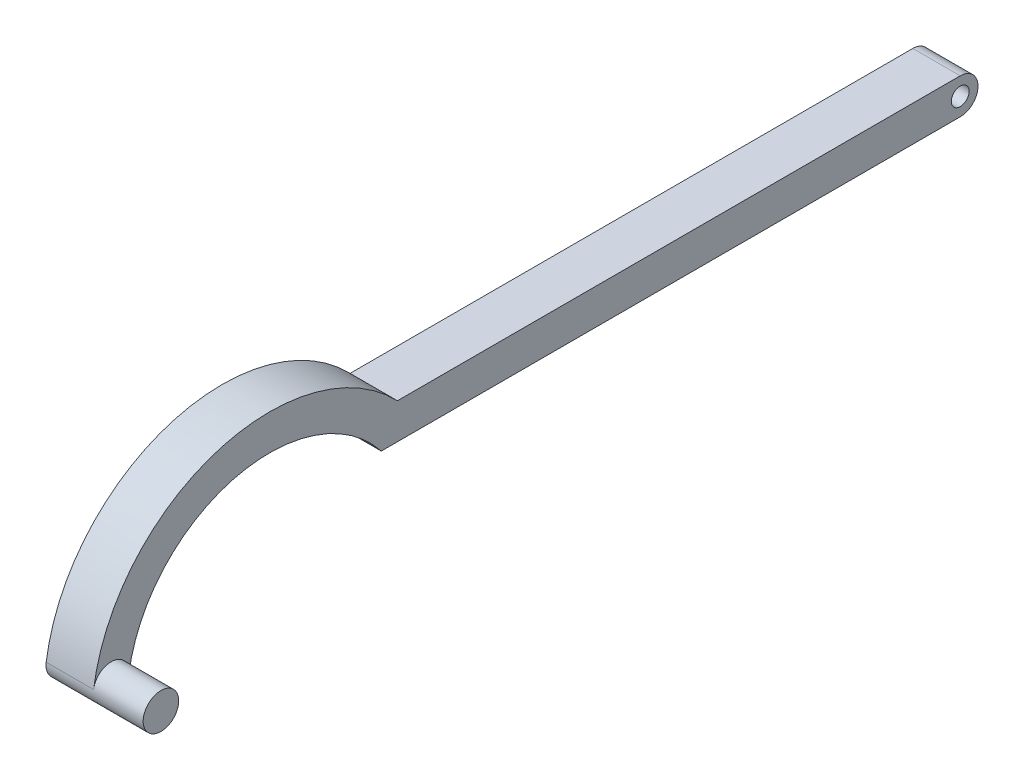
from build123d import *

# Parameters (mm, degrees)
SKETCH1_R           = 0.75
BOSS_EXTRUDE1_DEPTH = 4
SKETCH2_R           = 1.5
BOSS_EXTRUDE2_DEPTH = 4.2


with BuildPart() as part:
    # Sketch1 → Boss-Extrude1 (new body)
    with BuildSketch(Plane(origin=(0, 0, 0), x_dir=(0, 0, -1), z_dir=(1, 0, 0))):
        with BuildLine():
            Line((71.658914309, 8.5), (24.158914309, 8.5))
            ThreePointArc((24.158914309, 8.5), (8.750910997, 12.358734302), (-1.484840821, 0.212715152))
            ThreePointArc((-1.484840821, 0.212715152), (-0.212715152, -1.484840821), (1.484840821, -0.212715152))
            ThreePointArc((1.484840821, -0.212715152), (10.256916266, 9.676453105), (22.798933484, 5.5))
            Line((22.798933484, 5.5), (71.658914309, 5.5))
            ThreePointArc((71.658914309, 5.5), (73.158914309, 7), (71.658914309, 8.5))
        make_face()
        with Locations((71.658914309, 7)):
            Circle(SKETCH1_R, mode=Mode.SUBTRACT)
    extrude(amount=BOSS_EXTRUDE1_DEPTH)

    # Sketch2 → Boss-Extrude2 (add)
    with BuildSketch(Plane(origin=(4, 0, 0), x_dir=(0, 0, -1), z_dir=(1, 0, 0))):
        with Locations(Location((0, 0, 0), (0, 0, 171.847397423))):
            Circle(SKETCH2_R)
    extrude(amount=BOSS_EXTRUDE2_DEPTH)


solid = part.part
